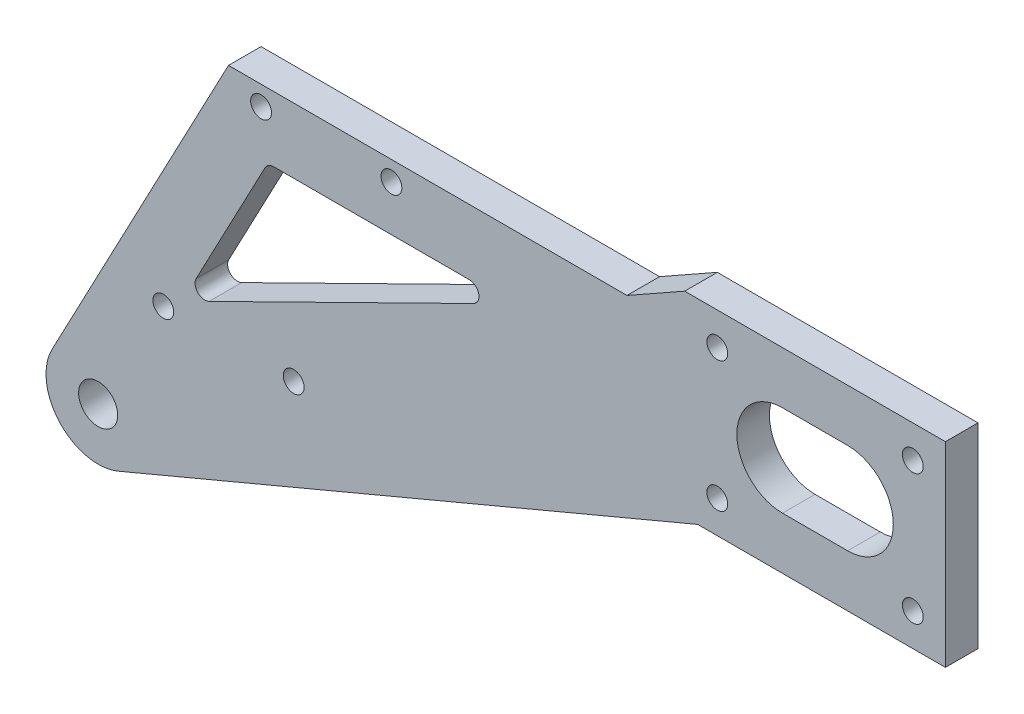
from build123d import *

# Parameters (mm, degrees)
SKETCH_1_R          = 3
SKETCH_1_R_2        = 1.6
EXTRUDE_1_DEPTH     = 5
EXTRUDE_2_DEPTH     = 5
SKETCH_4_R          = 1.6
CUT_EXTRUDE_1_DEPTH = 144.265487819
EXTRUDE_START       = -5
EXTRUDE_3_DEPTH     = 5
CUT_EXTRUDE_2_DEPTH = 144.265487819
SKETCH_7_R          = 1.6
CUT_EXTRUDE_3_DEPTH = 144.265487819


with BuildPart() as part:
    # 草图1 → 凸台-拉伸1 (new body)
    with BuildSketch(Plane.XY):
        with BuildLine():
            Line((-3.933140204, 6.966376973), (90, 60))
            Line((90, 60), (130, 60))
            Line((130, 60), (130, 30))
            Line((130, 30), (92, 30))
            Line((92, 30), (3.100465808, -7.374761811))
            ThreePointArc((3.100465808, -7.374761811), (-7.182645896, -3.522725923), (-3.933140204, 6.966376973))
        make_face()
        Circle(SKETCH_1_R, mode=Mode.SUBTRACT)
        with Locations((95, 55)):
            Circle(SKETCH_1_R_2, mode=Mode.SUBTRACT)
        with Locations((125, 55)):
            Circle(SKETCH_1_R_2, mode=Mode.SUBTRACT)
        with Locations((125, 35)):
            Circle(SKETCH_1_R_2, mode=Mode.SUBTRACT)
        with Locations((95, 35)):
            Circle(SKETCH_1_R_2, mode=Mode.SUBTRACT)
    extrude(amount=EXTRUDE_1_DEPTH)

    # 草图3 → 凸台-拉伸2 (add)
    with BuildSketch(Plane.XY.offset(5)):
        Polygon((81.144001216, 55), (20, 55), (20, 20.478766027), align=None)
    extrude(amount=-EXTRUDE_2_DEPTH)

    # 草图4 → 切除-拉伸1 (cut, through all)
    with BuildSketch(Plane.XY.offset(5)):
        with Locations((25, 52)):
            Circle(SKETCH_4_R)
        with Locations((45, 52)):
            Circle(SKETCH_4_R)
    extrude(amount=-CUT_EXTRUDE_1_DEPTH, mode=Mode.SUBTRACT)

    # 草图6 → 凸台-拉伸3 (add)
    with BuildSketch(Plane.XY.offset(5).offset(EXTRUDE_START)):
        with BuildLine():
            Line((-7.074049095, 3.736017853), (20, 55))
            Line((20, 55), (20, 20.478766027))
            Line((20, 20.478766027), (-3.933140204, 6.966376973))
            ThreePointArc((-3.933140204, 6.966376973), (-5.735709118, 5.576884517), (-7.074049095, 3.736017853))
        make_face()
    extrude(amount=EXTRUDE_3_DEPTH)

    # 草图5 → 切除-拉伸2 (cut, through all)
    with BuildSketch(Plane.XY.offset(5)):
        with BuildLine():
            Line((105, 52), (115, 52))
            ThreePointArc((115, 52), (122, 45), (115, 38))
            Line((115, 38), (105, 38))
            ThreePointArc((105, 38), (98, 45), (105, 52))
        make_face()
        with BuildLine():
            Line((25.605401824, 44.200503347), (15.042800964, 24.200503347))
            ThreePointArc((15.042800964, 24.200503347), (15.293877797, 22.454192152), (17.032531201, 22.154647985))
            Line((17.032531201, 22.154647985), (57.595132061, 42.154647985))
            ThreePointArc((57.595132061, 42.154647985), (58.392612512, 43.840567158), (56.93178603, 45))
            Line((56.93178603, 45), (26.93178603, 45))
            ThreePointArc((26.93178603, 45), (26.157433081, 44.784670195), (25.605401824, 44.200503347))
        make_face()
    extrude(amount=-CUT_EXTRUDE_2_DEPTH, mode=Mode.SUBTRACT)

    # 草图7 → 切除-拉伸3 (cut, through all)
    with BuildSketch(Plane.XY.offset(5)):
        with Locations((10, 18)):
            Circle(SKETCH_7_R)
        with Locations((30, 18)):
            Circle(SKETCH_7_R)
    extrude(amount=-CUT_EXTRUDE_3_DEPTH, mode=Mode.SUBTRACT)


solid = part.part
